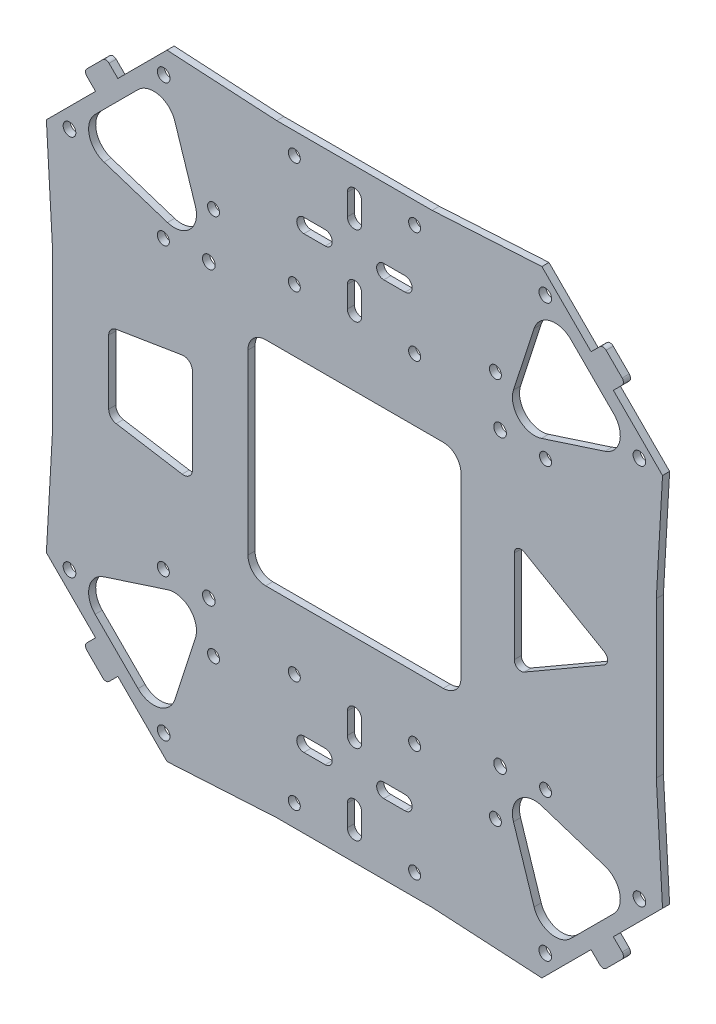
from build123d import *

# Parameters (mm, degrees)
BOSS_EXTRUDE1_DEPTH = 1.6
CUT_EXTRUDE1_DEPTH  = 99.159462101
SKETCH3_R           = 1.35
CUT_EXTRUDE2_DEPTH  = 10
SKETCH4_R           = 1.35
CUT_EXTRUDE3_DEPTH  = 10
FILLET1_R           = 1
FILLET2_R           = 1
SKETCH5_R           = 1.425
CUT_EXTRUDE4_DEPTH  = 10


with BuildPart() as part:
    # Sketch1 → Boss-Extrude1 (new body)
    with BuildSketch(Plane.XY):
        Polygon((68, 0), (68, 17.5), (69.4, 42.225), (58.322729073, 53.302270927), (61.009734842, 55.989276695), (58.499505769, 58.499505769), (55.989276695, 61.009734842), (53.302270927, 58.322729073), (42.225, 69.4), (17.5, 68), (0, 68), (-17.5, 68), (-42.225, 69.4), (-53.302270927, 58.322729073), (-55.989276695, 61.009734842), (-58.499505769, 58.499505769), (-61.009734842, 55.989276695), (-58.322729073, 53.302270927), (-69.4, 42.225), (-68, 17.5), (-68, 0), (-68, -17.5), (-69.4, -42.225), (-58.322729073, -53.302270927), (-61.009734842, -55.989276695), (-58.499505769, -58.499505769), (-55.989276695, -61.009734842), (-53.302270927, -58.322729073), (-42.225, -69.4), (-17.5, -68), (0, -68), (17.5, -68), (42.225, -69.4), (53.302270927, -58.322729073), (55.989276695, -61.009734842), (58.499505769, -58.499505769), (61.009734842, -55.989276695), (58.322729073, -53.302270927), (69.4, -42.225), (68, -17.5), align=None)
    extrude(amount=BOSS_EXTRUDE1_DEPTH)

    # Sketch2 → Cut-Extrude1 (cut, through all)
    with BuildSketch(Plane.XY.offset(1.6)):
        with BuildLine():
            Line((20, -24), (-20, -24))
            ThreePointArc((-20, -24), (-22.828427125, -22.828427125), (-24, -20))
            Line((-24, -20), (-24, 20))
            ThreePointArc((-24, 20), (-22.828427125, 22.828427125), (-20, 24))
            Line((-20, 24), (20, 24))
            ThreePointArc((20, 24), (22.828427125, 22.828427125), (24, 20))
            Line((24, 20), (24, -20))
            ThreePointArc((24, -20), (22.828427125, -22.828427125), (20, -24))
        make_face()
        with BuildLine():
            Line((36, 0), (36, 10.401923789))
            ThreePointArc((36, 10.401923789), (36.75, 11.700961894), (38.25, 11.700961894))
            Line((38.25, 11.700961894), (56.266660498, 1.299038106))
            ThreePointArc((56.266660498, 1.299038106), (57.016660498, 0), (56.266660498, -1.299038106))
            Line((56.266660498, -1.299038106), (38.25, -11.700961894))
            ThreePointArc((38.25, -11.700961894), (36.75, -11.700961894), (36, -10.401923789))
            Line((36, -10.401923789), (36, 0))
        make_face()
        with BuildLine():
            Line((-36.5, 0), (-36.5, 9.647504224))
            ThreePointArc((-36.5, 9.647504224), (-37.204560802, 11.171261844), (-38.821837285, 11.621439573))
            Line((-38.821837285, 11.621439573), (-53.681837285, 9.198613486))
            ThreePointArc((-53.681837285, 9.198613486), (-54.88375762, 8.520117335), (-55.36, 7.224678137))
            Line((-55.36, 7.224678137), (-55.36, 0))
            Line((-55.36, 0), (-55.36, -7.224678137))
            ThreePointArc((-55.36, -7.224678137), (-54.88375762, -8.520117335), (-53.681837285, -9.198613486))
            Line((-53.681837285, -9.198613486), (-38.821837285, -11.621439573))
            ThreePointArc((-38.821837285, -11.621439573), (-37.204560802, -11.171261844), (-36.5, -9.647504224))
            Line((-36.5, -9.647504224), (-36.5, 0))
        make_face()
    extrude(amount=-CUT_EXTRUDE1_DEPTH, mode=Mode.SUBTRACT)

    # Sketch3 → Cut-Extrude2 (cut)
    with BuildSketch(Plane.XY.offset(1.6)):
        with Locations((-43.05, -32.275)):
            Circle(SKETCH3_R)
        with Locations((-43.05, 32.275)):
            Circle(SKETCH3_R)
        with Locations((43.05, 32.275)):
            Circle(SKETCH3_R)
        with Locations((43.05, -32.275)):
            Circle(SKETCH3_R)
    extrude(amount=-CUT_EXTRUDE2_DEPTH, mode=Mode.SUBTRACT)

    # Sketch4 → Cut-Extrude3 (cut)
    with BuildSketch(Plane.XY.offset(1.6)):
        with Locations((-31.75, -43.6)):
            Circle(SKETCH4_R)
        with Locations((31.75, -43.6)):
            Circle(SKETCH4_R)
        with Locations((31.75, 43.6)):
            Circle(SKETCH4_R)
        with Locations((-31.75, 43.6)):
            Circle(SKETCH4_R)
        with Locations((13.55, -38.05)):
            Circle(SKETCH4_R)
        with Locations((-13.55, -38.05)):
            Circle(SKETCH4_R)
        with Locations((13.55, 38.05)):
            Circle(SKETCH4_R)
        with Locations((-13.55, 38.05)):
            Circle(SKETCH4_R)
        with Locations((-13.55, 63.15)):
            Circle(SKETCH4_R)
        with Locations((-13.55, -63.15)):
            Circle(SKETCH4_R)
        with Locations((13.55, -63.15)):
            Circle(SKETCH4_R)
        with Locations((13.55, 63.15)):
            Circle(SKETCH4_R)
        with BuildLine():
            Line((-6.6, -52.2), (-11.4, -52.2))
            ThreePointArc((-11.4, -52.2), (-13, -50.6), (-11.4, -49))
            Line((-11.4, -49), (-6.6, -49))
            ThreePointArc((-6.6, -49), (-5, -50.6), (-6.6, -52.2))
        make_face()
        with BuildLine():
            Line((-1.6, -57.2), (-1.6, -62))
            ThreePointArc((-1.6, -62), (0, -63.6), (1.6, -62))
            Line((1.6, -62), (1.6, -57.2))
            ThreePointArc((1.6, -57.2), (0, -55.6), (-1.6, -57.2))
        make_face()
        with BuildLine():
            Line((-1.6, -44), (-1.6, -39.2))
            ThreePointArc((-1.6, -39.2), (0, -37.6), (1.6, -39.2))
            Line((1.6, -39.2), (1.6, -44))
            ThreePointArc((1.6, -44), (0, -45.6), (-1.6, -44))
        make_face()
        with BuildLine():
            Line((6.6, -49), (11.4, -49))
            ThreePointArc((11.4, -49), (13, -50.6), (11.4, -52.2))
            Line((11.4, -52.2), (6.6, -52.2))
            ThreePointArc((6.6, -52.2), (5, -50.6), (6.6, -49))
        make_face()
        with BuildLine():
            Line((6.6, 49), (11.4, 49))
            ThreePointArc((11.4, 49), (13, 50.6), (11.4, 52.2))
            Line((11.4, 52.2), (6.6, 52.2))
            ThreePointArc((6.6, 52.2), (5, 50.6), (6.6, 49))
        make_face()
        with BuildLine():
            Line((-1.6, 57.2), (-1.6, 62))
            ThreePointArc((-1.6, 62), (0, 63.6), (1.6, 62))
            Line((1.6, 62), (1.6, 57.2))
            ThreePointArc((1.6, 57.2), (0, 55.6), (-1.6, 57.2))
        make_face()
        with BuildLine():
            Line((-1.6, 44), (-1.6, 39.2))
            ThreePointArc((-1.6, 39.2), (0, 37.6), (1.6, 39.2))
            Line((1.6, 39.2), (1.6, 44))
            ThreePointArc((1.6, 44), (0, 45.6), (-1.6, 44))
        make_face()
        with BuildLine():
            Line((-6.6, 52.2), (-11.4, 52.2))
            ThreePointArc((-11.4, 52.2), (-13, 50.6), (-11.4, 49))
            Line((-11.4, 49), (-6.6, 49))
            ThreePointArc((-6.6, 49), (-5, 50.6), (-6.6, 52.2))
        make_face()
    extrude(amount=-CUT_EXTRUDE3_DEPTH, mode=Mode.SUBTRACT)

    # Fillet1
    fillet1_edges = [part.edges().sort_by_distance(p)[0] for p in [
        (-61.009734842, 55.989276695, 0.8),
        (-55.989276695, 61.009734842, 0.8),
    ]]
    fillet(fillet1_edges, radius=FILLET1_R)

    # Fillet2
    fillet2_edges = [part.edges().sort_by_distance(p)[0] for p in [
        (55.989276695, 61.009734842, 0.8),
        (61.009734842, 55.989276695, 0.8),
        (61.009734842, -55.989276695, 0.8),
        (55.989276695, -61.009734842, 0.8),
        (-55.989276695, -61.009734842, 0.8),
        (-61.009734842, -55.989276695, 0.8),
    ]]
    fillet(fillet2_edges, radius=FILLET2_R)

    # Sketch5 → Cut-Extrude4 (cut)
    with BuildSketch(Plane.XY.offset(1.6)):
        with Locations((-64.195104916, 42.98190148)):
            Circle(SKETCH5_R)
        with Locations((-42.98190148, 64.195104916)):
            Circle(SKETCH5_R)
        with Locations((-32.803838757, 32.80406237)):
            Circle(SKETCH5_R)
        with Locations((42.98190148, 64.195104916)):
            Circle(SKETCH5_R)
        with Locations((64.195104916, 42.98190148)):
            Circle(SKETCH5_R)
        with Locations((32.80406237, 32.803838757)):
            Circle(SKETCH5_R)
        with Locations((64.195104916, -42.98190148)):
            Circle(SKETCH5_R)
        with Locations((42.98190148, -64.195104916)):
            Circle(SKETCH5_R)
        with Locations((32.803838757, -32.80406237)):
            Circle(SKETCH5_R)
        with Locations((-42.98190148, -64.195104916)):
            Circle(SKETCH5_R)
        with Locations((-64.195104916, -42.98190148)):
            Circle(SKETCH5_R)
        with Locations((-32.80406237, -32.803838757)):
            Circle(SKETCH5_R)
        with BuildLine():
            Line((-35.825790321, 42.124324259), (-40.463610522, 56.42822621))
            ThreePointArc((-40.463610522, 56.42822621), (-44.051116398, 59.747576432), (-48.755383713, 58.421622683))
            Line((-48.755383713, 58.421622683), (-58.421567356, 48.75543904))
            ThreePointArc((-58.421567356, 48.75543904), (-59.747516117, 44.051150977), (-56.428130285, 40.463652686))
            Line((-56.428130285, 40.463652686), (-42.124126441, 35.825934378))
            ThreePointArc((-42.124126441, 35.825934378), (-37.046480611, 37.04666801), (-35.825790321, 42.124324259))
        make_face()
        with BuildLine():
            Line((40.463652686, 56.428130285), (35.825934378, 42.124126441))
            ThreePointArc((35.825934378, 42.124126441), (37.04666801, 37.046480611), (42.124324259, 35.825790321))
            Line((42.124324259, 35.825790321), (56.42822621, 40.463610522))
            ThreePointArc((56.42822621, 40.463610522), (59.747576432, 44.051116398), (58.421622683, 48.755383713))
            Line((58.421622683, 48.755383713), (48.75543904, 58.421567356))
            ThreePointArc((48.75543904, 58.421567356), (44.051150977, 59.747516117), (40.463652686, 56.428130285))
        make_face()
        with BuildLine():
            Line((56.428130285, -40.463652686), (42.124126441, -35.825934378))
            ThreePointArc((42.124126441, -35.825934378), (37.046480611, -37.04666801), (35.825790321, -42.124324259))
            Line((35.825790321, -42.124324259), (40.463610522, -56.42822621))
            ThreePointArc((40.463610522, -56.42822621), (44.051116398, -59.747576432), (48.755383713, -58.421622683))
            Line((48.755383713, -58.421622683), (58.421567356, -48.75543904))
            ThreePointArc((58.421567356, -48.75543904), (59.747516117, -44.051150977), (56.428130285, -40.463652686))
        make_face()
        with BuildLine():
            Line((-40.463652686, -56.428130285), (-35.825934378, -42.124126441))
            ThreePointArc((-35.825934378, -42.124126441), (-37.04666801, -37.046480611), (-42.124324259, -35.825790321))
            Line((-42.124324259, -35.825790321), (-56.42822621, -40.463610522))
            ThreePointArc((-56.42822621, -40.463610522), (-59.747576432, -44.051116398), (-58.421622683, -48.755383713))
            Line((-58.421622683, -48.755383713), (-48.75543904, -58.421567356))
            ThreePointArc((-48.75543904, -58.421567356), (-44.051150977, -59.747516117), (-40.463652686, -56.428130285))
        make_face()
    extrude(amount=-CUT_EXTRUDE4_DEPTH, mode=Mode.SUBTRACT)


solid = part.part
